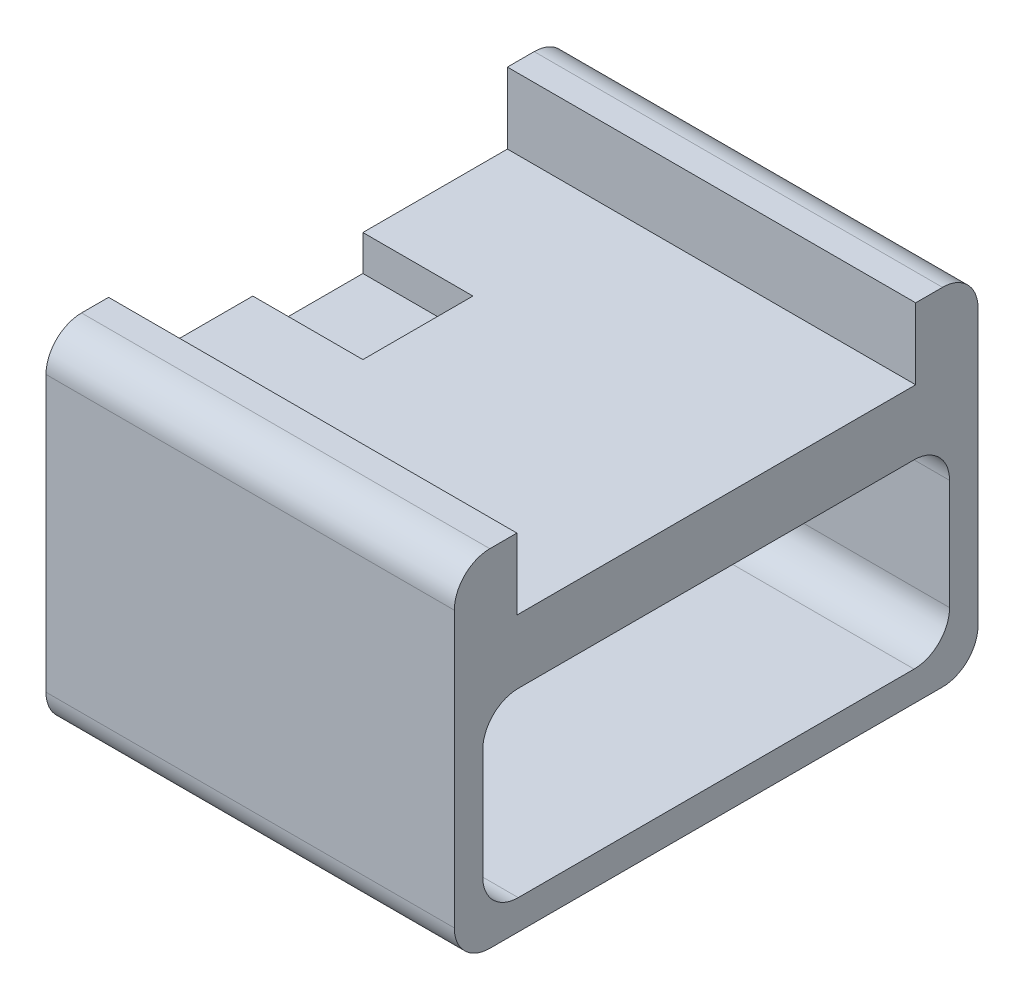
from build123d import *

# Parameters (mm, degrees)
BOSS_EXTRUDE1_DEPTH     = 23
SKETCH5_W               = 6.2
SKETCH5_H               = 6.2
CUT_EXTRUDE1_DEPTH      = 6
CUT_EXTRUDE2_DEPTH      = 30.010773861
CUT_EXTRUDE2_DEPTH_BACK = 30.010773861
SKETCH9_W               = 24.284850455
SKETCH9_H               = 22.464844075
CUT_EXTRUDE3_DEPTH      = 4


with BuildPart() as part:
    # Sketch3 → Boss-Extrude1 (new body)
    with BuildSketch(Plane(origin=(0, 0, 0), x_dir=(0, 0, -1), z_dir=(1, 0, 0))):
        with BuildLine():
            Line((-12.75, -9.75), (12.75, -9.75))
            ThreePointArc((12.75, -9.75), (14.164213562, -9.164213562), (14.75, -7.75))
            Line((14.75, -7.75), (14.75, 7.75))
            ThreePointArc((14.75, 7.75), (14.164213562, 9.164213562), (12.75, 9.75))
            Line((12.75, 9.75), (-12.75, 9.75))
            ThreePointArc((-12.75, 9.75), (-14.164213562, 9.164213562), (-14.75, 7.75))
            Line((-14.75, 7.75), (-14.75, -7.75))
            ThreePointArc((-14.75, -7.75), (-14.164213562, -9.164213562), (-12.75, -9.75))
        make_face()
    extrude(amount=BOSS_EXTRUDE1_DEPTH)

    # Sketch5 → Cut-Extrude1 (cut)
    with BuildSketch(Plane(origin=(0, 9.75, 0), x_dir=(1, 0, 0), z_dir=(0, 1, 0))):
        with Locations((3.1, 0)):
            Rectangle(SKETCH5_W, SKETCH5_H)
    extrude(amount=-CUT_EXTRUDE1_DEPTH, mode=Mode.SUBTRACT)

    # Sketch7 → Cut-Extrude2 (cut, two sides: drawn at the far end of the back side and taken through both)
    with BuildSketch(Plane.ZY.offset(-CUT_EXTRUDE2_DEPTH_BACK)):
        with BuildLine():
            Line((-11.147623693, -8.072928754), (11.147623693, -8.072928754))
            ThreePointArc((11.147623693, -8.072928754), (12.561837255, -7.487142316), (13.147623693, -6.072928754))
            Line((13.147623693, -6.072928754), (13.147623693, 0.135263404))
            ThreePointArc((13.147623693, 0.135263404), (12.561837255, 1.549476966), (11.147623693, 2.135263404))
            Line((11.147623693, 2.135263404), (-11.147623693, 2.135263404))
            ThreePointArc((-11.147623693, 2.135263404), (-12.561837255, 1.549476966), (-13.147623693, 0.135263404))
            Line((-13.147623693, 0.135263404), (-13.147623693, -6.072928754))
            ThreePointArc((-13.147623693, -6.072928754), (-12.561837255, -7.487142316), (-11.147623693, -8.072928754))
        make_face()
    extrude(amount=CUT_EXTRUDE2_DEPTH + CUT_EXTRUDE2_DEPTH_BACK, mode=Mode.SUBTRACT)

    # Sketch9 → Cut-Extrude3 (cut)
    with BuildSketch(Plane(origin=(0, 9.75, 0), x_dir=(1, 0, 0), z_dir=(0, 1, 0))):
        with Locations((12.142425228, 0.007615305)):
            Rectangle(SKETCH9_W, SKETCH9_H)
    extrude(amount=-CUT_EXTRUDE3_DEPTH, mode=Mode.SUBTRACT)


solid = part.part
